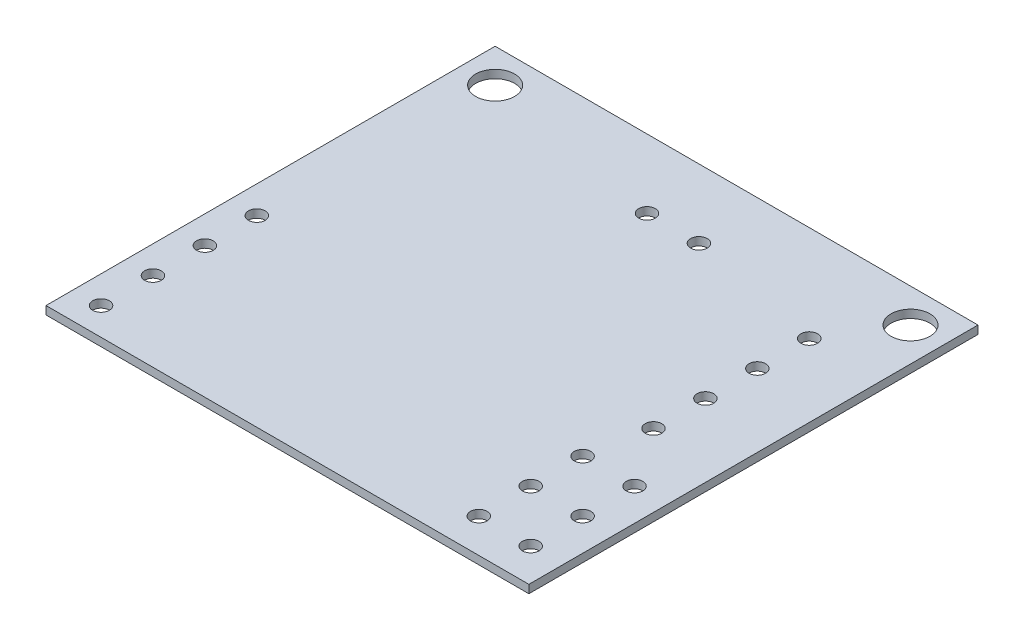
from build123d import *

# Parameters (mm, degrees)
SKETCH1_W           = 23.622
SKETCH1_H           = 21.971
SKETCH1_R           = 0.9525
SKETCH1_R_2         = 0.4064
BOSS_EXTRUDE1_DEPTH = 0.4


with BuildPart() as part:
    # Sketch1 → Boss-Extrude1 (new body)
    with BuildSketch(Plane(origin=(0, 0, 0), x_dir=(1, 0, 0), z_dir=(0, 1, 0))):
        with Locations((11.811, 10.9855)):
            Rectangle(SKETCH1_W, SKETCH1_H)
        with Locations(Location((1.651, 20.32, 0), (0, 0, 270))):
            Circle(SKETCH1_R, mode=Mode.SUBTRACT)
        with Locations(Location((21.971, 20.32, 0), (0, 0, 270))):
            Circle(SKETCH1_R, mode=Mode.SUBTRACT)
        with Locations(Location((13.335, 18.6055, 0), (0, 0, 270))):
            Circle(SKETCH1_R_2, mode=Mode.SUBTRACT)
        with Locations(Location((10.795, 18.6055, 0), (0, 0, 270))):
            Circle(SKETCH1_R_2, mode=Mode.SUBTRACT)
        with Locations(Location((1.3462, 8.9662, 0), (0, 0, 270))):
            Circle(SKETCH1_R_2, mode=Mode.SUBTRACT)
        with Locations(Location((1.3462, 6.4262, 0), (0, 0, 270))):
            Circle(SKETCH1_R_2, mode=Mode.SUBTRACT)
        with Locations(Location((1.3462, 3.8862, 0), (0, 0, 270))):
            Circle(SKETCH1_R_2, mode=Mode.SUBTRACT)
        with Locations(Location((1.3462, 1.3462, 0), (0, 0, 270))):
            Circle(SKETCH1_R_2, mode=Mode.SUBTRACT)
        with Locations(Location((22.0472, 1.6637, 0), (0, 0, 270))):
            Circle(SKETCH1_R_2, mode=Mode.SUBTRACT)
        with Locations(Location((19.5072, 1.6637, 0), (0, 0, 270))):
            Circle(SKETCH1_R_2, mode=Mode.SUBTRACT)
        with Locations(Location((19.5072, 4.2037, 0), (0, 0, 270))):
            Circle(SKETCH1_R_2, mode=Mode.SUBTRACT)
        with Locations(Location((19.5072, 6.7437, 0), (0, 0, 270))):
            Circle(SKETCH1_R_2, mode=Mode.SUBTRACT)
        with Locations(Location((22.0472, 4.2037, 0), (0, 0, 270))):
            Circle(SKETCH1_R_2, mode=Mode.SUBTRACT)
        with Locations(Location((22.0472, 6.7437, 0), (0, 0, 270))):
            Circle(SKETCH1_R_2, mode=Mode.SUBTRACT)
        with Locations(Location((20.066, 9.652, 0), (0, 0, 270))):
            Circle(SKETCH1_R_2, mode=Mode.SUBTRACT)
        with Locations(Location((20.066, 12.192, 0), (0, 0, 270))):
            Circle(SKETCH1_R_2, mode=Mode.SUBTRACT)
        with Locations(Location((20.066, 14.732, 0), (0, 0, 270))):
            Circle(SKETCH1_R_2, mode=Mode.SUBTRACT)
        with Locations(Location((20.066, 17.272, 0), (0, 0, 270))):
            Circle(SKETCH1_R_2, mode=Mode.SUBTRACT)
    extrude(amount=BOSS_EXTRUDE1_DEPTH)


solid = part.part
